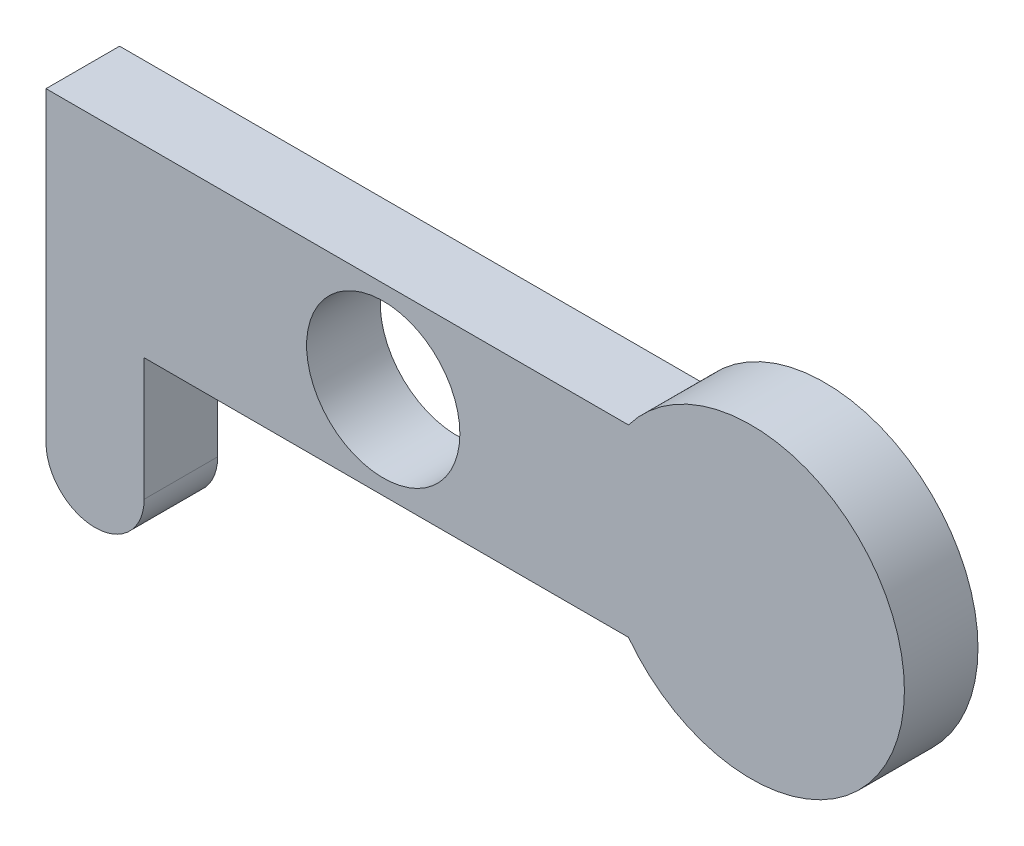
from build123d import *

# Parameters (mm, degrees)
SCHIZZO1_R                   = 6.25
ESTRUSIONE_ESTRUSIONE1_DEPTH = 6


with BuildPart() as part:
    # Schizzo1 → Estrusione-Estrusione1 (new body)
    with BuildSketch(Plane.XY):
        with BuildLine():
            Line((0, 0), (-19.5, 0))
            Line((-19.5, 0), (-19.5, -10))
            ThreePointArc((-19.5, -10), (-23.5, -14), (-27.5, -10))
            Line((-27.5, -10), (-27.5, 15))
            Line((-27.5, 15), (8.032195982, 15))
            Line((8.032195982, 15), (20, 15))
            ThreePointArc((20, 15), (42.5, 7.5), (20, 0))
            Line((20, 0), (0, 0))
        make_face()
        with Locations((0, 7.5)):
            Circle(SCHIZZO1_R, mode=Mode.SUBTRACT)
    extrude(amount=ESTRUSIONE_ESTRUSIONE1_DEPTH)


solid = part.part
